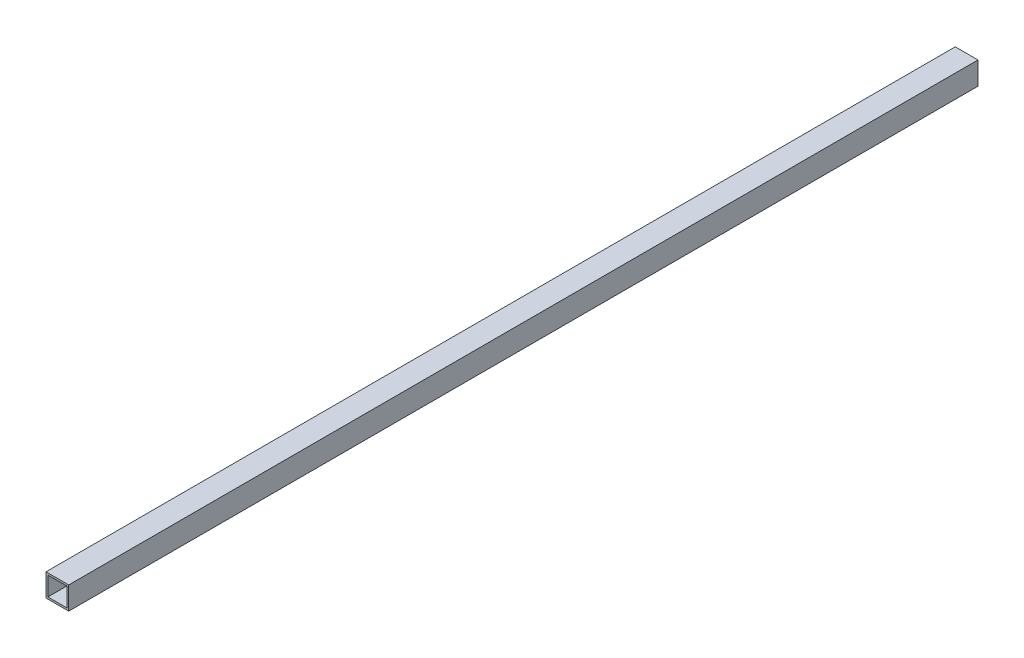
from build123d import *

# Parameters (mm, degrees)
SKETCH1_W           = 19.05
SKETCH1_H           = 19.05
SKETCH1_W_2         = 15.875
SKETCH1_H_2         = 15.875
BOSS_EXTRUDE1_DEPTH = 381


with BuildPart() as part:
    # Sketch1 → Boss-Extrude1 (new, symmetric)
    with BuildSketch(Plane.XY):
        Rectangle(SKETCH1_W, SKETCH1_H)
        Rectangle(SKETCH1_W_2, SKETCH1_H_2, mode=Mode.SUBTRACT)
    extrude(amount=BOSS_EXTRUDE1_DEPTH, both=True)


solid = part.part
